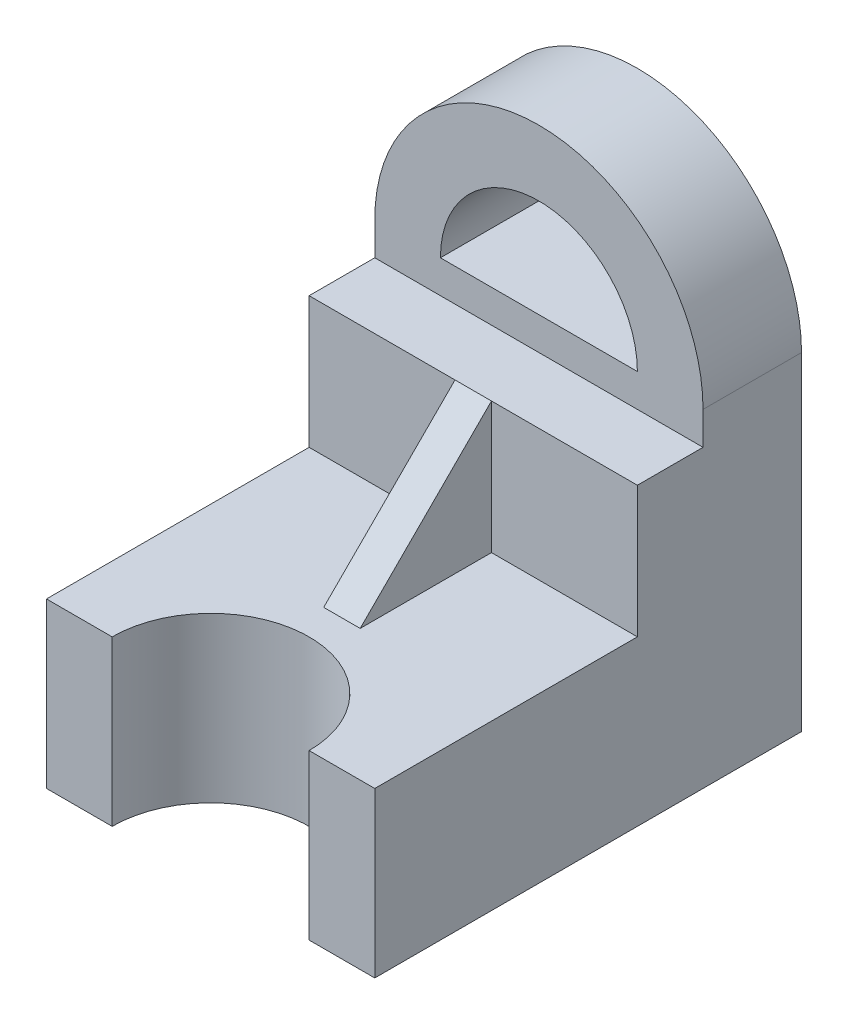
from build123d import *

# Parameters (mm, degrees)
BOSS_EXTRUDE1_DEPTH = 117
BOSS_EXTRUDE2_START = -72
BOSS_EXTRUDE2_DEPTH = 45
BOSS_EXTRUDE4_START = -90
BOSS_EXTRUDE4_DEPTH = 27
BOSS_EXTRUDE5_START = -90
BOSS_EXTRUDE5_DEPTH = 27
CUT_EXTRUDE1_DEPTH  = 173.884354411
RIB4_REACH          = 186.225
SKETCH5_WALL_W      = 421.362499074
SKETCH5_WALL_H      = 10


with BuildPart() as part:
    # Sketch1 → Boss-Extrude1 (new body)
    with BuildSketch(Plane.XY):
        Polygon((0, 45), (0, 0), (90, 0), (90, 45), (68.497865987, 45), align=None)
    extrude(amount=-BOSS_EXTRUDE1_DEPTH)

    # Sketch1<3> → Boss-Extrude2 (add)
    with BuildSketch(Plane.XY.offset(BOSS_EXTRUDE2_START)):
        Polygon((0, 81), (0, 45), (68.497865987, 45), (90, 45), (90, 81), align=None)
    extrude(amount=-BOSS_EXTRUDE2_DEPTH)

    # Sketch1<5> → Boss-Extrude4 (add)
    with BuildSketch(Plane.XY.offset(BOSS_EXTRUDE4_START)):
        Polygon((0, 90), (0, 81), (90, 81), (90, 90), (72, 90), (18, 90), align=None)
    extrude(amount=-BOSS_EXTRUDE4_DEPTH)

    # Sketch1<6> → Boss-Extrude5 (add)
    with BuildSketch(Plane.XY.offset(BOSS_EXTRUDE5_START)):
        with BuildLine():
            ThreePointArc((90, 90), (45, 135), (0, 90))
            Line((0, 90), (18, 90))
            ThreePointArc((18, 90), (45, 117), (72, 90))
            Line((72, 90), (90, 90))
        make_face()
    extrude(amount=-BOSS_EXTRUDE5_DEPTH)

    # Sketch2 → Cut-Extrude1 (cut, through all)
    with BuildSketch(Plane(origin=(0, 45, 0), x_dir=(1, 0, 0), z_dir=(0, 1, 0))):
        with BuildLine():
            Line((18, 0), (72, 0))
            ThreePointArc((72, 0), (45, 27), (18, 0))
        make_face()
    extrude(amount=-CUT_EXTRUDE1_DEPTH, mode=Mode.SUBTRACT)

    # Sketch5 wall → Rib4 (add, up to next)
    with BuildSketch(Plane(origin=(45, 63, -54), x_dir=(0, -0.707106781187, 0.707106781187), z_dir=(0, -0.707106781187, -0.707106781187)), mode=Mode.PRIVATE) as rib4_sk1:
        Rectangle(SKETCH5_WALL_W, SKETCH5_WALL_H)
    rib4_tool1 = extrude(rib4_sk1.sketch, amount=RIB4_REACH, mode=Mode.PRIVATE) - part.part
    add(rib4_tool1.solids().sort_by_distance((45, 63, -54))[0])


solid = part.part
